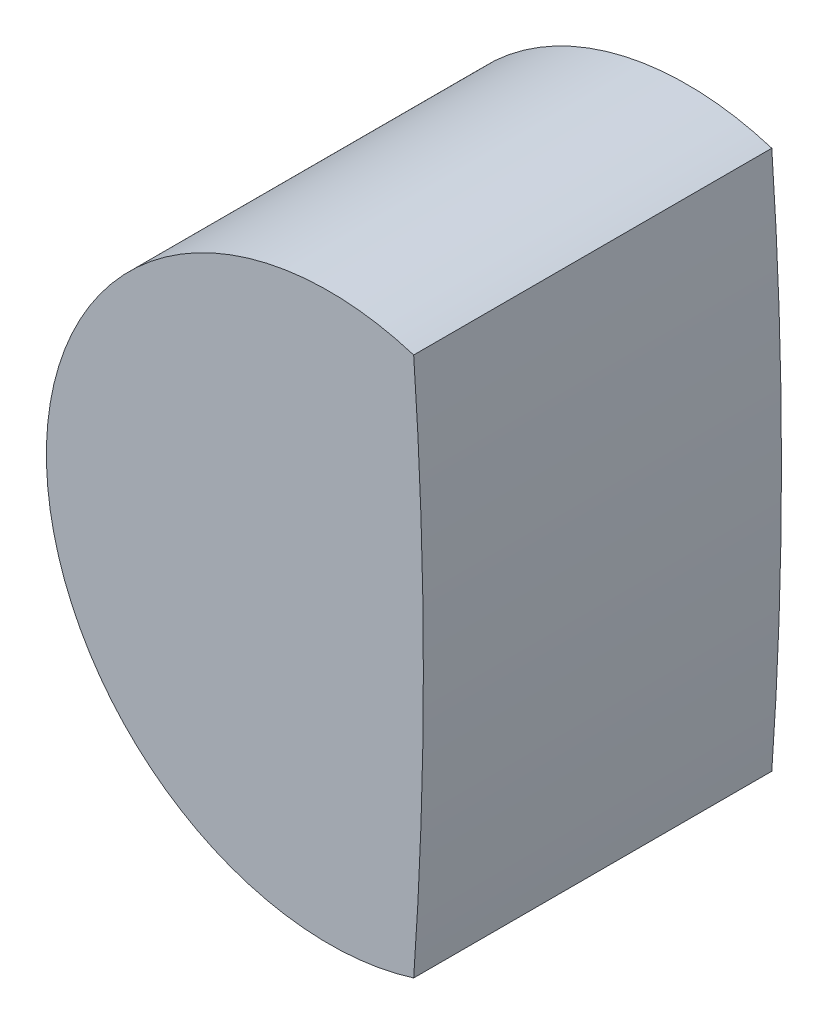
from build123d import *

# Parameters (mm, degrees)
BOSS_EXTRU_1_DEPTH = 1.9


with BuildPart() as part:
    # Esquisse1 → Boss.-Extru.1 (new body)
    with BuildSketch(Plane.XY):
        with BuildLine():
            ThreePointArc((0.448717949, 1.431311358), (-1.5, 0), (0.448717949, -1.431311358))
            ThreePointArc((0.448717949, -1.431311358), (0.5, 0), (0.448717949, 1.431311358))
        make_face()
    extrude(amount=BOSS_EXTRU_1_DEPTH)


solid = part.part
